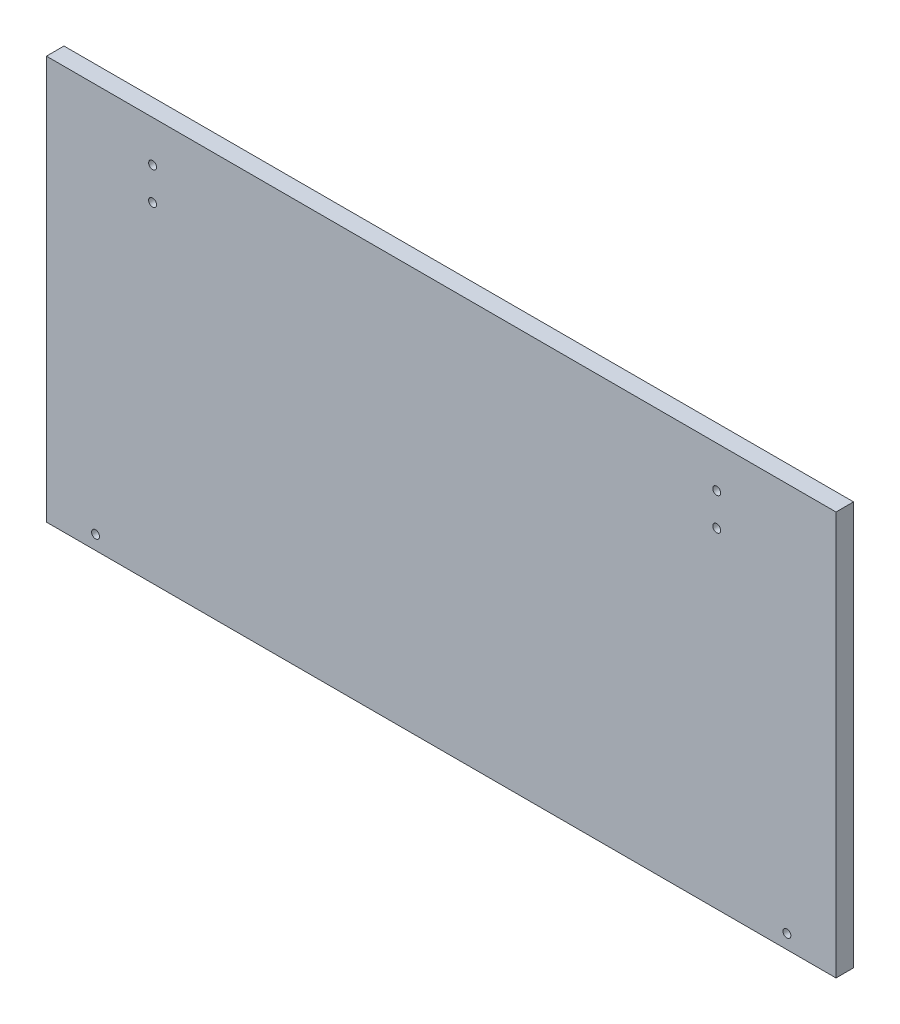
from build123d import *

# Parameters (mm, degrees)
SCHIZZO1_W                   = 450
SCHIZZO1_H                   = 230
ESTRUSIONE_ESTRUSIONE1_DEPTH = 10
SCHIZZO2_R                   = 2.25
TAGLIO_ESTRUSIONE1_DEPTH     = 10
SCHIZZO3_R                   = 2.25
TAGLIO_ESTRUSIONE2_DEPTH     = 10


with BuildPart() as part:
    # Schizzo1 → Estrusione-Estrusione1 (new body)
    with BuildSketch(Plane.XY):
        Rectangle(SCHIZZO1_W, SCHIZZO1_H)
    extrude(amount=ESTRUSIONE_ESTRUSIONE1_DEPTH)

    # Schizzo2 → Taglio-Estrusione1 (cut)
    with BuildSketch(Plane(origin=(0, 0, 0), x_dir=(-1, 0, 0), z_dir=(0, 0, -1))):
        with Locations((-157, 91.5)):
            Circle(SCHIZZO2_R)
        with Locations((-157, 73)):
            Circle(SCHIZZO2_R)
        with Locations((164.5, 91.5)):
            Circle(SCHIZZO2_R)
        with Locations((164.5, 73)):
            Circle(SCHIZZO2_R)
    extrude(amount=-TAGLIO_ESTRUSIONE1_DEPTH, mode=Mode.SUBTRACT)

    # Schizzo3 → Taglio-Estrusione2 (cut)
    with BuildSketch(Plane(origin=(0, 0, 0), x_dir=(-1, 0, 0), z_dir=(0, 0, -1))):
        with Locations((197, -107)):
            Circle(SCHIZZO3_R)
        with Locations((-197, -107)):
            Circle(SCHIZZO3_R)
    extrude(amount=-TAGLIO_ESTRUSIONE2_DEPTH, mode=Mode.SUBTRACT)


solid = part.part
